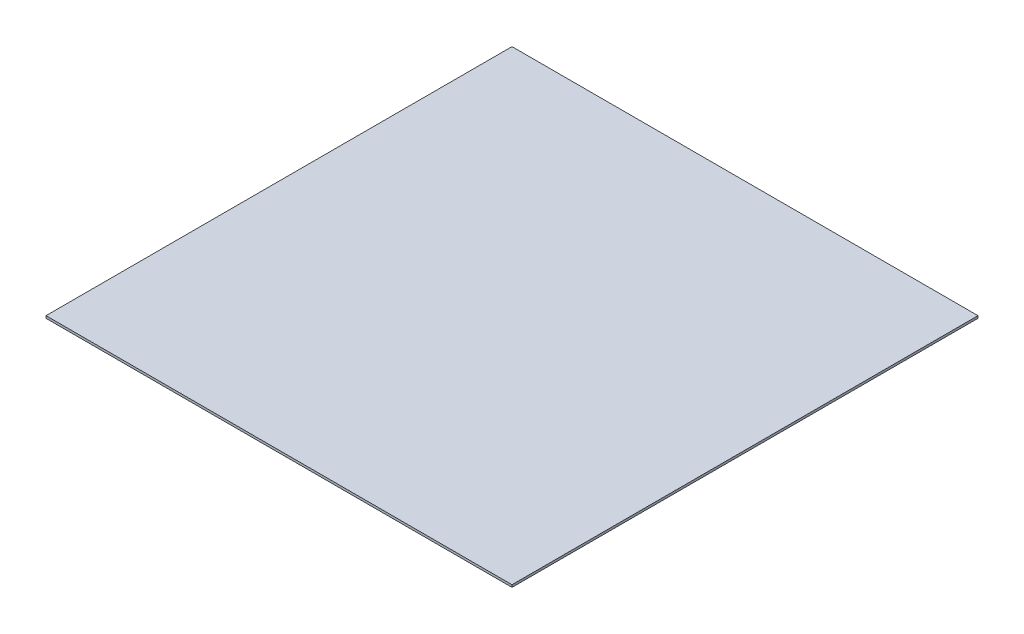
from build123d import *

# Parameters (mm, degrees)
SKETCH1_W           = 100
SKETCH1_H           = 100
BOSS_EXTRUDE1_DEPTH = 0.5


with BuildPart() as part:
    # Sketch1 → Boss-Extrude1 (new body)
    with BuildSketch(Plane(origin=(0, 0, 0), x_dir=(1, 0, 0), z_dir=(0, 1, 0))):
        with Locations((-50, 45.41114675)):
            Rectangle(SKETCH1_W, SKETCH1_H)
    extrude(amount=BOSS_EXTRUDE1_DEPTH)


solid = part.part
